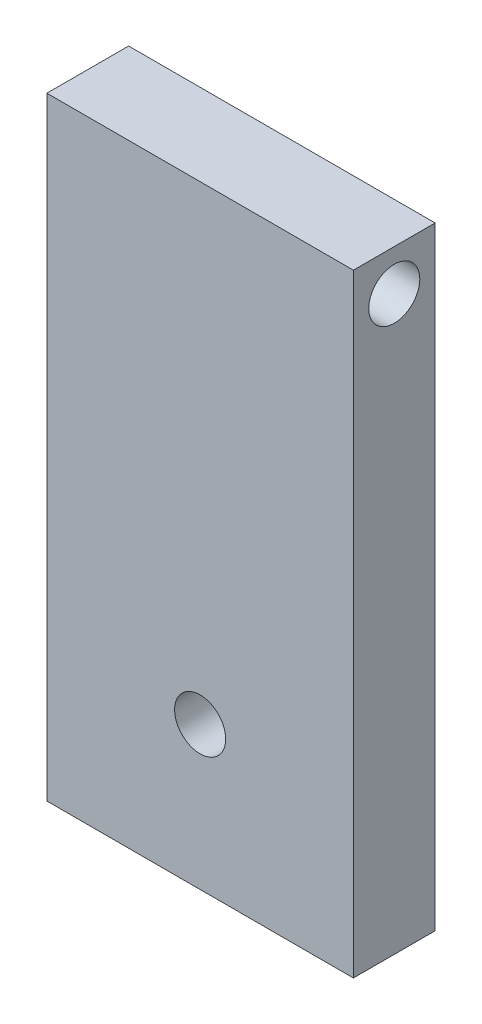
from build123d import *

# Parameters (mm, degrees)
CROQUIS1_W              = 30
CROQUIS1_H              = 60
SALIENTE_EXTRUIR1_DEPTH = 8
CROQUIS2_R              = 2.5
CORTAR_EXTRUIR1_DEPTH   = 44.17406629
CROQUIS3_R              = 2
CORTAR_EXTRUIR2_DEPTH   = 15
CROQUIS4_R              = 2.5
CORTAR_EXTRUIR3_DEPTH   = 35.481879299


with BuildPart() as part:
    # Croquis1 → Saliente-Extruir1 (new body)
    with BuildSketch(Plane.XY):
        Rectangle(CROQUIS1_W, CROQUIS1_H)
    extrude(amount=-SALIENTE_EXTRUIR1_DEPTH)

    # Croquis2 → Cortar-Extruir1 (cut, through all)
    with BuildSketch(Plane(origin=(15, 0, 0), x_dir=(0, 0, -1), z_dir=(1, 0, 0))):
        with Locations(Location((4, 26, 0), (0, 0, 90))):
            Circle(CROQUIS2_R)
    extrude(amount=-CORTAR_EXTRUIR1_DEPTH, mode=Mode.SUBTRACT)

    # Croquis3 → Cortar-Extruir2 (cut)
    with BuildSketch(Plane.XZ.offset(30)):
        with Locations(Location((-10, -4, 0), (0, 0, 270))):
            Circle(CROQUIS3_R)
        with Locations(Location((10, -4, 0), (0, 0, 270))):
            Circle(CROQUIS3_R)
    extrude(amount=-CORTAR_EXTRUIR2_DEPTH, mode=Mode.SUBTRACT)

    # Croquis4 → Cortar-Extruir3 (cut, through all)
    with BuildSketch(Plane.XY):
        with Locations((0, -16)):
            Circle(CROQUIS4_R)
    extrude(amount=-CORTAR_EXTRUIR3_DEPTH, mode=Mode.SUBTRACT)


solid = part.part
